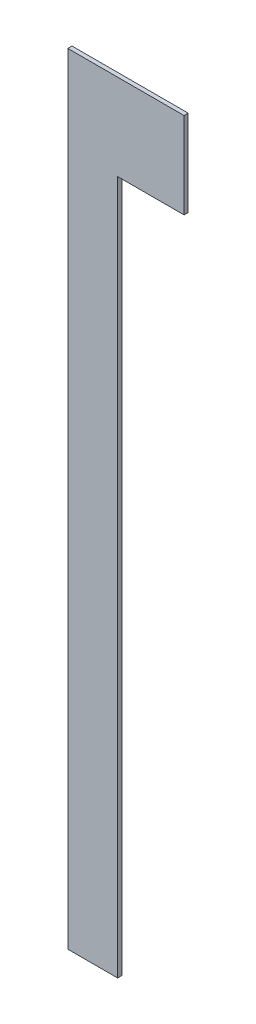
from build123d import *

# Parameters (mm, degrees)
EXTRUDE_1_DEPTH = 12.5


with BuildPart() as part:
    # Эскиз1 → Бобышка-Вытянуть1 (new body)
    with BuildSketch(Plane.XY):
        Polygon((350, -0.75), (0, -0.75), (0, -2350), (150, -2350), (150, -260), (350, -260), align=None)
    extrude(amount=-EXTRUDE_1_DEPTH)


solid = part.part
